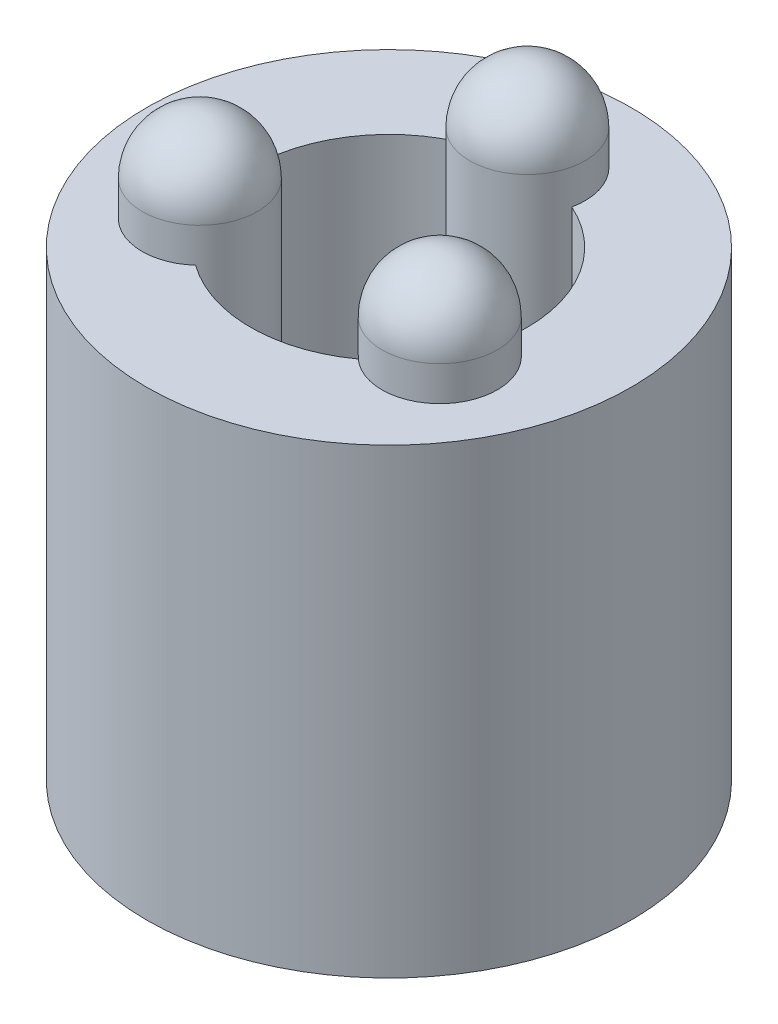
from build123d import *

# Parameters (mm, degrees)
CROQUIS1_R                   = 5.25
SALIENTE_EXTRUIR1_DEPTH      = 10
CROQUIS2_R                   = 3
CORTAR_EXTRUIR1_DEPTH        = 10
SALIENTE_EXTRUIR2_DEPTH      = 2
SALIENTE_EXTRUIR2_DEPTH_BACK = 10
CROQUIS3_R                   = 1.25
REDONDEO1_R                  = 1.25


with BuildPart() as part:
    # Croquis1 → Saliente-Extruir1 (new body)
    with BuildSketch(Plane(origin=(0, 0, 0), x_dir=(1, 0, 0), z_dir=(0, 1, 0))):
        with Locations(Location((0, 0, 0), (0, 0, 270))):
            Circle(CROQUIS1_R)
    extrude(amount=SALIENTE_EXTRUIR1_DEPTH)

    # Croquis2 → Cortar-Extruir1 (cut)
    with BuildSketch(Plane(origin=(0, 10, 0), x_dir=(1, 0, 0), z_dir=(0, 1, 0))):
        with Locations(Location((0, 0, 0), (0, 0, 270))):
            Circle(CROQUIS2_R)
    extrude(amount=-CORTAR_EXTRUIR1_DEPTH, mode=Mode.SUBTRACT)

    # Croquis3 → Saliente-Extruir2 (add, two sides: drawn at the far end of the back side and taken through both)
    with BuildSketch(Plane(origin=(0, 10, 0), x_dir=(1, 0, 0), z_dir=(0, 1, 0)).offset(-SALIENTE_EXTRUIR2_DEPTH_BACK)):
        with Locations(Location((0, 3, 0), (0, 0, 270))):
            Circle(CROQUIS3_R)
        with Locations(Location((2.599576211, -1.499133975, 0), (0, 0, 270))):
            Circle(CROQUIS3_R)
        with Locations(Location((-2.596576211, -1.500866025, 0), (0, 0, 270))):
            Circle(CROQUIS3_R)
    extrude(amount=SALIENTE_EXTRUIR2_DEPTH + SALIENTE_EXTRUIR2_DEPTH_BACK)

    # Redondeo1
    redondeo1_edges = [part.edges().sort_by_distance(p)[0] for p in [
        (0, 12, -4.25),
        (2.599576211, 12, 0.249133975),
        (-2.596576211, 12, 0.250866025),
    ]]
    fillet(redondeo1_edges, radius=REDONDEO1_R)


solid = part.part
